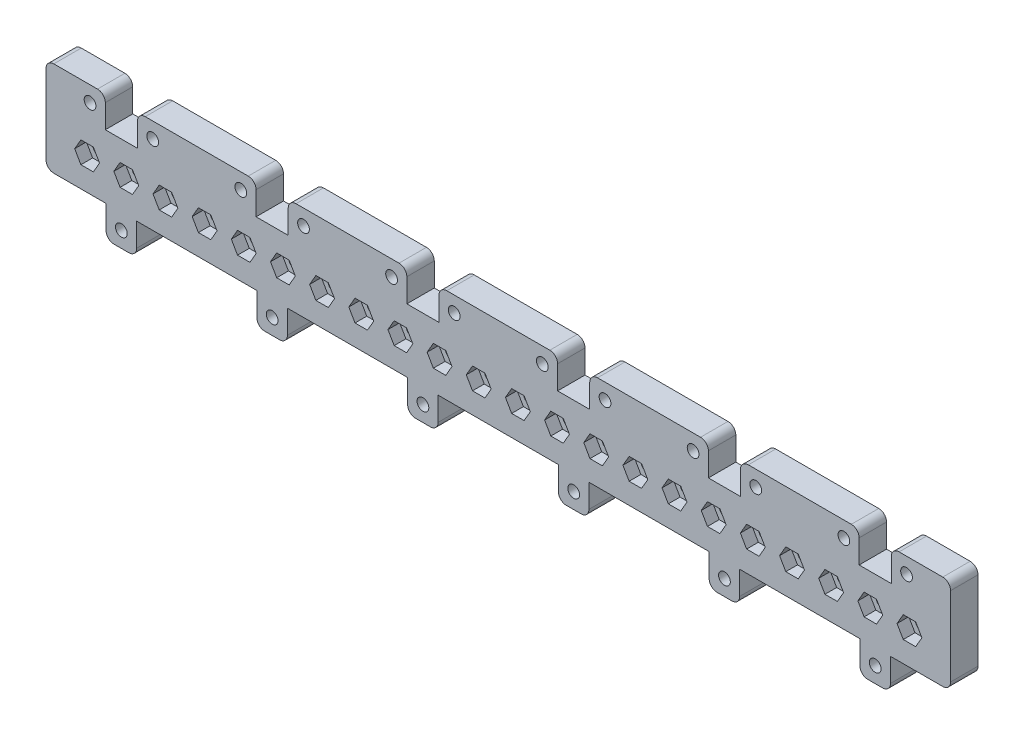
from build123d import *

# Parameters (mm, degrees)
SKETCH_1_W                        = 231
SKETCH_1_H                        = 32.2
EXTRUDE_1_DEPTH                   = 7
SKETCH_4_R                        = 1.5
CUT_EXTRUDE_3_DEPTH               = 117.826623678
SKETCH_9_R                        = 3
CUT_EXTRUDE_7_DEPTH               = 3
PATTERN_LINEAR_2_COUNT            = 5
PATTERN_LINEAR_2_PITCH            = 38.5
PATTERN_LINEAR_2_COL_COUNT        = 2
PATTERN_LINEAR_2_COL_PITCH        = 38.5
PATTERN_LINEAR_3_COUNT            = 2
PATTERN_LINEAR_3_PITCH            = 24.2
PATTERN_LINEAR_3_COPY_1_SKETCH_R  = 1.5
PATTERN_LINEAR_3_COPY_1_DEPTH     = 117.826623678
PATTERN_LINEAR_3_COPY_2_SKETCH_R  = 1.5
PATTERN_LINEAR_3_COPY_2_DEPTH     = 117.826623678
PATTERN_LINEAR_3_COPY_3_SKETCH_R  = 1.5
PATTERN_LINEAR_3_COPY_3_DEPTH     = 117.826623678
PATTERN_LINEAR_3_COPY_4_SKETCH_R  = 1.5
PATTERN_LINEAR_3_COPY_4_DEPTH     = 117.826623678
PATTERN_LINEAR_3_COPY_5_SKETCH_R  = 3
PATTERN_LINEAR_3_COPY_5_DEPTH     = 3
PATTERN_LINEAR_3_COPY_6_SKETCH_R  = 3
PATTERN_LINEAR_3_COPY_6_DEPTH     = 3
PATTERN_LINEAR_3_COPY_7_SKETCH_R  = 3
PATTERN_LINEAR_3_COPY_7_DEPTH     = 3
PATTERN_LINEAR_3_COPY_8_SKETCH_R  = 3
PATTERN_LINEAR_3_COPY_8_DEPTH     = 3
PATTERN_LINEAR_3_COPY_9_SKETCH_R  = 1.5
PATTERN_LINEAR_3_COPY_9_DEPTH     = 117.826623678
PATTERN_LINEAR_3_COPY_10_SKETCH_R = 3
PATTERN_LINEAR_3_COPY_10_DEPTH    = 3
SKETCH_12_W                       = 8.2
SKETCH_12_H                       = 8
SKETCH_12_W_2                     = 15.35
CUT_EXTRUDE_13_DEPTH              = 10
PATTERN_LINEAR_5_COUNT            = 6
PATTERN_LINEAR_5_PITCH            = 38.5
PATTERN_LINEAR_5_COUNT_DIR2       = 6
PATTERN_LINEAR_5_PITCH_DIR2       = 38.5
FILLET_3_R                        = 2
SKETCH_10_R                       = 1.5
CUT_EXTRUDE_8_DEPTH               = 117.826623678
CUT_EXTRUDE_9_DEPTH               = 3
PATTERN_LINEAR_4_COUNT            = 12
PATTERN_LINEAR_4_PITCH            = 10
PATTERN_LINEAR_4_COL_COUNT        = 11
PATTERN_LINEAR_4_COL_PITCH        = 10


with BuildPart() as part:
    # 草图1 → 凸台-拉伸1 (new body)
    with BuildSketch(Plane.XY):
        Rectangle(SKETCH_1_W, SKETCH_1_H)
    extrude(amount=EXTRUDE_1_DEPTH)

    # 草图4 → 切除-拉伸3 (cut, through all)
    with BuildSketch(Plane(origin=(0, 0, 0), x_dir=(-1, 0, 0), z_dir=(0, 0, -1))):
        with Locations((-65.75, 12.1)):
            Circle(SKETCH_4_R)
        with Locations((-57.75, 12.1)):
            Circle(SKETCH_4_R)
        with Locations((-49.75, 12.1)):
            Circle(SKETCH_4_R)
    cut_extrude_3 = extrude(amount=-CUT_EXTRUDE_3_DEPTH, mode=Mode.SUBTRACT)

    # 草图9 → 切除-拉伸7 (cut)
    with BuildSketch(Plane(origin=(0, 0, 0), x_dir=(-1, 0, 0), z_dir=(0, 0, -1))):
        with Locations((-65.75, 12.1)):
            Circle(SKETCH_9_R)
        with Locations((-57.75, 12.1)):
            Circle(SKETCH_9_R)
        with Locations((-49.75, 12.1)):
            Circle(SKETCH_9_R)
    cut_extrude_7 = extrude(amount=-CUT_EXTRUDE_7_DEPTH, mode=Mode.SUBTRACT)

    # 阵列(线性)2: 切除-拉伸3, 切除-拉伸7 ×5
    with Locations(*[(-i * PATTERN_LINEAR_2_PITCH, 0, 0) for i in range(1, PATTERN_LINEAR_2_COUNT)]):
        add(cut_extrude_3, mode=Mode.SUBTRACT)
        add(cut_extrude_7, mode=Mode.SUBTRACT)

    # 阵列(线性)2 col: 切除-拉伸3, 切除-拉伸7 ×2
    with Locations(*[(i * PATTERN_LINEAR_2_COL_PITCH, 0, 0) for i in range(1, PATTERN_LINEAR_2_COL_COUNT)]):
        add(cut_extrude_3, mode=Mode.SUBTRACT)
        add(cut_extrude_7, mode=Mode.SUBTRACT)

    # 阵列(线性)3: 切除-拉伸3, 切除-拉伸7 ×2
    with Locations(*[(0, -i * PATTERN_LINEAR_3_PITCH, 0) for i in range(1, PATTERN_LINEAR_3_COUNT)]):
        add(cut_extrude_3, mode=Mode.SUBTRACT)
        add(cut_extrude_7, mode=Mode.SUBTRACT)

    # 阵列(线性)3 copy 1 sketch → 阵列(线性)3 copy 1 (cut, through all)
    with BuildSketch(Plane(origin=(-38.5, -24.2, 0), x_dir=(-1, 0, 0), z_dir=(0, 0, -1))):
        with Locations((-65.75, 12.1)):
            Circle(PATTERN_LINEAR_3_COPY_1_SKETCH_R)
        with Locations((-57.75, 12.1)):
            Circle(PATTERN_LINEAR_3_COPY_1_SKETCH_R)
        with Locations((-49.75, 12.1)):
            Circle(PATTERN_LINEAR_3_COPY_1_SKETCH_R)
    extrude(amount=-PATTERN_LINEAR_3_COPY_1_DEPTH, mode=Mode.SUBTRACT)

    # 阵列(线性)3 copy 2 sketch → 阵列(线性)3 copy 2 (cut, through all)
    with BuildSketch(Plane(origin=(-77, -24.2, 0), x_dir=(-1, 0, 0), z_dir=(0, 0, -1))):
        with Locations((-65.75, 12.1)):
            Circle(PATTERN_LINEAR_3_COPY_2_SKETCH_R)
        with Locations((-57.75, 12.1)):
            Circle(PATTERN_LINEAR_3_COPY_2_SKETCH_R)
        with Locations((-49.75, 12.1)):
            Circle(PATTERN_LINEAR_3_COPY_2_SKETCH_R)
    extrude(amount=-PATTERN_LINEAR_3_COPY_2_DEPTH, mode=Mode.SUBTRACT)

    # 阵列(线性)3 copy 3 sketch → 阵列(线性)3 copy 3 (cut, through all)
    with BuildSketch(Plane(origin=(-115.5, -24.2, 0), x_dir=(-1, 0, 0), z_dir=(0, 0, -1))):
        with Locations((-65.75, 12.1)):
            Circle(PATTERN_LINEAR_3_COPY_3_SKETCH_R)
        with Locations((-57.75, 12.1)):
            Circle(PATTERN_LINEAR_3_COPY_3_SKETCH_R)
        with Locations((-49.75, 12.1)):
            Circle(PATTERN_LINEAR_3_COPY_3_SKETCH_R)
    extrude(amount=-PATTERN_LINEAR_3_COPY_3_DEPTH, mode=Mode.SUBTRACT)

    # 阵列(线性)3 copy 4 sketch → 阵列(线性)3 copy 4 (cut, through all)
    with BuildSketch(Plane(origin=(-154, -24.2, 0), x_dir=(-1, 0, 0), z_dir=(0, 0, -1))):
        with Locations((-65.75, 12.1)):
            Circle(PATTERN_LINEAR_3_COPY_4_SKETCH_R)
        with Locations((-57.75, 12.1)):
            Circle(PATTERN_LINEAR_3_COPY_4_SKETCH_R)
        with Locations((-49.75, 12.1)):
            Circle(PATTERN_LINEAR_3_COPY_4_SKETCH_R)
    extrude(amount=-PATTERN_LINEAR_3_COPY_4_DEPTH, mode=Mode.SUBTRACT)

    # 阵列(线性)3 copy 5 sketch → 阵列(线性)3 copy 5 (cut)
    with BuildSketch(Plane(origin=(-38.5, -24.2, 0), x_dir=(-1, 0, 0), z_dir=(0, 0, -1))):
        with Locations((-65.75, 12.1)):
            Circle(PATTERN_LINEAR_3_COPY_5_SKETCH_R)
        with Locations((-57.75, 12.1)):
            Circle(PATTERN_LINEAR_3_COPY_5_SKETCH_R)
        with Locations((-49.75, 12.1)):
            Circle(PATTERN_LINEAR_3_COPY_5_SKETCH_R)
    extrude(amount=-PATTERN_LINEAR_3_COPY_5_DEPTH, mode=Mode.SUBTRACT)

    # 阵列(线性)3 copy 6 sketch → 阵列(线性)3 copy 6 (cut)
    with BuildSketch(Plane(origin=(-77, -24.2, 0), x_dir=(-1, 0, 0), z_dir=(0, 0, -1))):
        with Locations((-65.75, 12.1)):
            Circle(PATTERN_LINEAR_3_COPY_6_SKETCH_R)
        with Locations((-57.75, 12.1)):
            Circle(PATTERN_LINEAR_3_COPY_6_SKETCH_R)
        with Locations((-49.75, 12.1)):
            Circle(PATTERN_LINEAR_3_COPY_6_SKETCH_R)
    extrude(amount=-PATTERN_LINEAR_3_COPY_6_DEPTH, mode=Mode.SUBTRACT)

    # 阵列(线性)3 copy 7 sketch → 阵列(线性)3 copy 7 (cut)
    with BuildSketch(Plane(origin=(-115.5, -24.2, 0), x_dir=(-1, 0, 0), z_dir=(0, 0, -1))):
        with Locations((-65.75, 12.1)):
            Circle(PATTERN_LINEAR_3_COPY_7_SKETCH_R)
        with Locations((-57.75, 12.1)):
            Circle(PATTERN_LINEAR_3_COPY_7_SKETCH_R)
        with Locations((-49.75, 12.1)):
            Circle(PATTERN_LINEAR_3_COPY_7_SKETCH_R)
    extrude(amount=-PATTERN_LINEAR_3_COPY_7_DEPTH, mode=Mode.SUBTRACT)

    # 阵列(线性)3 copy 8 sketch → 阵列(线性)3 copy 8 (cut)
    with BuildSketch(Plane(origin=(-154, -24.2, 0), x_dir=(-1, 0, 0), z_dir=(0, 0, -1))):
        with Locations((-65.75, 12.1)):
            Circle(PATTERN_LINEAR_3_COPY_8_SKETCH_R)
        with Locations((-57.75, 12.1)):
            Circle(PATTERN_LINEAR_3_COPY_8_SKETCH_R)
        with Locations((-49.75, 12.1)):
            Circle(PATTERN_LINEAR_3_COPY_8_SKETCH_R)
    extrude(amount=-PATTERN_LINEAR_3_COPY_8_DEPTH, mode=Mode.SUBTRACT)

    # 阵列(线性)3 copy 9 sketch → 阵列(线性)3 copy 9 (cut, through all)
    with BuildSketch(Plane(origin=(38.5, -24.2, 0), x_dir=(-1, 0, 0), z_dir=(0, 0, -1))):
        with Locations((-65.75, 12.1)):
            Circle(PATTERN_LINEAR_3_COPY_9_SKETCH_R)
        with Locations((-57.75, 12.1)):
            Circle(PATTERN_LINEAR_3_COPY_9_SKETCH_R)
        with Locations((-49.75, 12.1)):
            Circle(PATTERN_LINEAR_3_COPY_9_SKETCH_R)
    extrude(amount=-PATTERN_LINEAR_3_COPY_9_DEPTH, mode=Mode.SUBTRACT)

    # 阵列(线性)3 copy 10 sketch → 阵列(线性)3 copy 10 (cut)
    with BuildSketch(Plane(origin=(38.5, -24.2, 0), x_dir=(-1, 0, 0), z_dir=(0, 0, -1))):
        with Locations((-65.75, 12.1)):
            Circle(PATTERN_LINEAR_3_COPY_10_SKETCH_R)
        with Locations((-57.75, 12.1)):
            Circle(PATTERN_LINEAR_3_COPY_10_SKETCH_R)
        with Locations((-49.75, 12.1)):
            Circle(PATTERN_LINEAR_3_COPY_10_SKETCH_R)
    extrude(amount=-PATTERN_LINEAR_3_COPY_10_DEPTH, mode=Mode.SUBTRACT)

    # 草图12 → 切除-拉伸13 (cut)
    with BuildSketch(Plane.XY):
        with Locations((-96.25, 12.1)):
            Rectangle(SKETCH_12_W, SKETCH_12_H)
        with Locations((-107.825, -12.1)):
            Rectangle(SKETCH_12_W_2, SKETCH_12_H)
        with Locations((-84.675, -12.1)):
            Rectangle(SKETCH_12_W_2, SKETCH_12_H)
    cut_extrude_13 = extrude(amount=CUT_EXTRUDE_13_DEPTH, mode=Mode.SUBTRACT)

    # 阵列(线性)5: Cut-Extrude 13 6 × 6
    with Locations(*[(i * PATTERN_LINEAR_5_PITCH, j * PATTERN_LINEAR_5_PITCH_DIR2, 0) for i in range(PATTERN_LINEAR_5_COUNT) for j in range(PATTERN_LINEAR_5_COUNT_DIR2) if (i, j) != (0, 0)]):
        add(cut_extrude_13, mode=Mode.SUBTRACT)

    # 圆角3
    fillet_3_edges = [part.edges().sort_by_distance(p)[0] for p in [
        (-100.35, 16.1, 3.5),
        (-92.15, 16.1, 3.5),
        (-100.15, -16.1, 3.5),
        (-115.5, -8.1, 3.5),
        (-92.35, -16.1, 3.5),
        (92.15, 16.1, 3.5),
        (100.35, 16.1, 3.5),
        (53.65, 16.1, 3.5),
        (61.85, 16.1, 3.5),
        (15.15, 16.1, 3.5),
        (23.35, 16.1, 3.5),
        (-23.35, 16.1, 3.5),
        (-15.15, 16.1, 3.5),
        (-61.85, 16.1, 3.5),
        (-53.65, 16.1, 3.5),
        (-23.15, -16.1, 3.5),
        (15.35, -16.1, 3.5),
        (53.85, -16.1, 3.5),
        (92.35, -16.1, 3.5),
        (-61.65, -16.1, 3.5),
        (115.5, -8.1, 3.5),
        (100.15, -16.1, 3.5),
        (61.65, -16.1, 3.5),
        (-115.5, 16.1, 3.5),
        (23.15, -16.1, 3.5),
        (115.5, 16.1, 3.5),
        (-15.35, -16.1, 3.5),
        (-53.85, -16.1, 3.5),
    ]]
    fillet(fillet_3_edges, radius=FILLET_3_R)

    # 草图10 → 切除-拉伸8 (cut, through all)
    with BuildSketch(Plane.XY.offset(7)):
        with Locations((-5, 0)):
            Circle(SKETCH_10_R)
    cut_extrude_8 = extrude(amount=-CUT_EXTRUDE_8_DEPTH, mode=Mode.SUBTRACT)

    # 草图11 → 切除-拉伸9 (cut)
    with BuildSketch(Plane.XY.offset(7)):
        Polygon((-1.824573519, 0), (-3.41228676, 2.75), (-6.58771324, 2.75), (-8.175426481, 0), (-6.58771324, -2.75), (-3.41228676, -2.75), align=None)
    cut_extrude_9 = extrude(amount=-CUT_EXTRUDE_9_DEPTH, mode=Mode.SUBTRACT)

    # 阵列(线性)4: 切除-拉伸8, 切除-拉伸9 ×12
    with Locations(*[(i * PATTERN_LINEAR_4_PITCH, 0, 0) for i in range(1, PATTERN_LINEAR_4_COUNT)]):
        add(cut_extrude_8, mode=Mode.SUBTRACT)
        add(cut_extrude_9, mode=Mode.SUBTRACT)

    # 阵列(线性)4 col: 切除-拉伸8, 切除-拉伸9 ×11
    with Locations(*[(-i * PATTERN_LINEAR_4_COL_PITCH, 0, 0) for i in range(1, PATTERN_LINEAR_4_COL_COUNT)]):
        add(cut_extrude_8, mode=Mode.SUBTRACT)
        add(cut_extrude_9, mode=Mode.SUBTRACT)


solid = part.part
